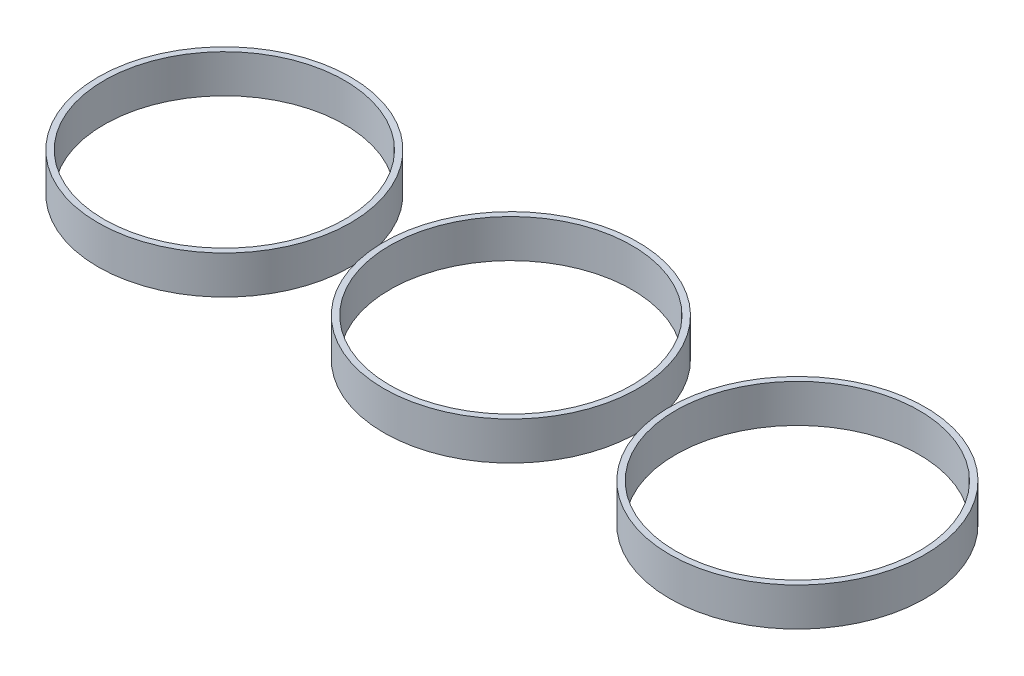
from build123d import *

# Parameters (mm, degrees)
SKETCH2_R               = 26.45
BOSS_EXTRUDE1_DEPTH     = 8
CUT_EXTRUDE1_DEPTH      = 39.2518627
CUT_EXTRUDE1_DEPTH_BACK = 39.2518627
SKETCH3_R               = 25.2
SKETCH5_R               = 26.6
BOSS_EXTRUDE2_DEPTH     = 8
CUT_EXTRUDE2_DEPTH      = 91.945698084
CUT_EXTRUDE2_DEPTH_BACK = 91.945698084
SKETCH6_R               = 25.35
SKETCH7_R               = 26.75
BOSS_EXTRUDE3_DEPTH     = 8
CUT_EXTRUDE3_DEPTH      = 150.382478892
CUT_EXTRUDE3_DEPTH_BACK = 150.382478892
SKETCH8_R               = 25.5


with BuildPart() as part:
    # Sketch2 → Boss-Extrude1 (new body)
    with BuildSketch(Plane(origin=(0, 0, 0), x_dir=(1, 0, 0), z_dir=(0, 1, 0))):
        with Locations(Location((0, 0, 0), (0, 0, 270))):
            Circle(SKETCH2_R)
    extrude(amount=BOSS_EXTRUDE1_DEPTH)

    # Sketch3 → Cut-Extrude1 (cut, two sides: drawn at the far end of the back side and taken through both)
    with BuildSketch(Plane(origin=(0, 8, 0), x_dir=(1, 0, 0), z_dir=(0, 1, 0)).offset(-CUT_EXTRUDE1_DEPTH_BACK)):
        with Locations(Location((0, 0, 0), (0, 0, 270))):
            Circle(SKETCH3_R)
    extrude(amount=CUT_EXTRUDE1_DEPTH + CUT_EXTRUDE1_DEPTH_BACK, mode=Mode.SUBTRACT)


with BuildPart() as body_2:
    # Sketch5 → Boss-Extrude2 (new body)
    with BuildSketch(Plane(origin=(0, 0, 0), x_dir=(1, 0, 0), z_dir=(0, 1, 0))):
        with Locations(Location((60, 0, 0), (0, 0, 270))):
            Circle(SKETCH5_R)
    extrude(amount=BOSS_EXTRUDE2_DEPTH)

    # Sketch6 → Cut-Extrude2 (cut, two sides: drawn at the far end of the back side and taken through both)
    with BuildSketch(Plane(origin=(0, 8, 0), x_dir=(1, 0, 0), z_dir=(0, 1, 0)).offset(-CUT_EXTRUDE2_DEPTH_BACK)):
        with Locations(Location((60, 0, 0), (0, 0, 270))):
            Circle(SKETCH6_R)
    extrude(amount=CUT_EXTRUDE2_DEPTH + CUT_EXTRUDE2_DEPTH_BACK, mode=Mode.SUBTRACT)


with BuildPart() as body_3:
    # Sketch7 → Boss-Extrude3 (new body)
    with BuildSketch(Plane(origin=(0, 0, 0), x_dir=(1, 0, 0), z_dir=(0, 1, 0))):
        with Locations(Location((120, 0, 0), (0, 0, 270))):
            Circle(SKETCH7_R)
    extrude(amount=BOSS_EXTRUDE3_DEPTH)

    # Sketch8 → Cut-Extrude3 (cut, two sides: drawn at the far end of the back side and taken through both)
    with BuildSketch(Plane(origin=(0, 8, 0), x_dir=(1, 0, 0), z_dir=(0, 1, 0)).offset(-CUT_EXTRUDE3_DEPTH_BACK)):
        with Locations(Location((120, 0, 0), (0, 0, 270))):
            Circle(SKETCH8_R)
    extrude(amount=CUT_EXTRUDE3_DEPTH + CUT_EXTRUDE3_DEPTH_BACK, mode=Mode.SUBTRACT)


solid = Compound([part.part, body_2.part, body_3.part])
